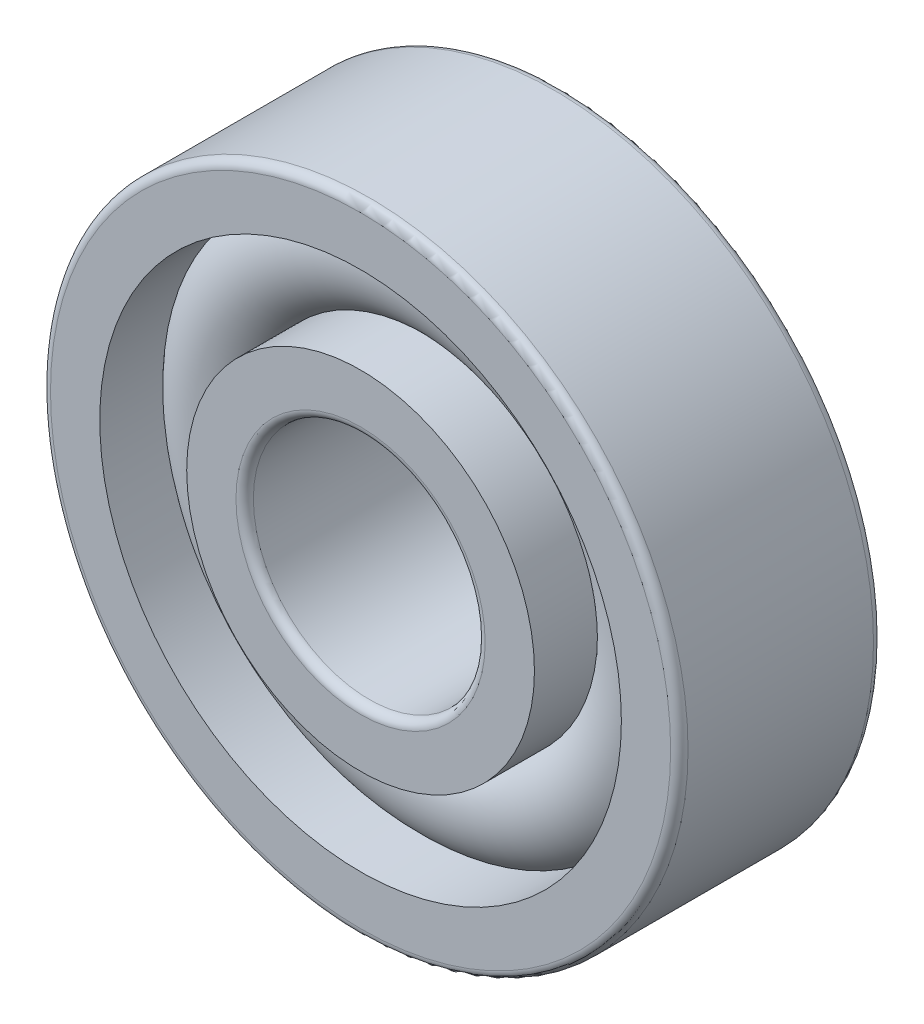
from build123d import *


with BuildPart() as part:
    # Sketch1 → Revolve1 (revolve)
    with BuildSketch(Plane(origin=(0, 0, 0), x_dir=(0, 0, -1), z_dir=(1, 0, 0)), mode=Mode.PRIVATE) as revolve1_sk:
        with BuildLine():
            Line((-3.5, 6), (-3.5, 4.3))
            ThreePointArc((-3.5, 4.3), (-3.412132034, 4.087867966), (-3.2, 4))
            Line((-3.2, 4), (3.2, 4))
            ThreePointArc((3.2, 4), (3.412132034, 4.087867966), (3.5, 4.3))
            Line((3.5, 4.3), (3.5, 6))
            Line((3.5, 6), (1.322875656, 6))
            ThreePointArc((1.322875656, 6), (2, 7.5), (1.322875656, 9))
            Line((1.322875656, 9), (3.5, 9))
            Line((3.5, 9), (3.5, 10.7))
            ThreePointArc((3.5, 10.7), (3.412132034, 10.912132034), (3.2, 11))
            Line((3.2, 11), (-3.2, 11))
            ThreePointArc((-3.2, 11), (-3.412132034, 10.912132034), (-3.5, 10.7))
            Line((-3.5, 10.7), (-3.5, 9))
            Line((-3.5, 9), (-1.322875656, 9))
            ThreePointArc((-1.322875656, 9), (-2, 7.5), (-1.322875656, 6))
            Line((-1.322875656, 6), (-3.5, 6))
        make_face()
    revolve(revolve1_sk.sketch.rotate(Axis((0, 0, 0), (0, 0, -1)), 90), axis=Axis((0, 0, 0), (0, 0, -1)))


solid = part.part
